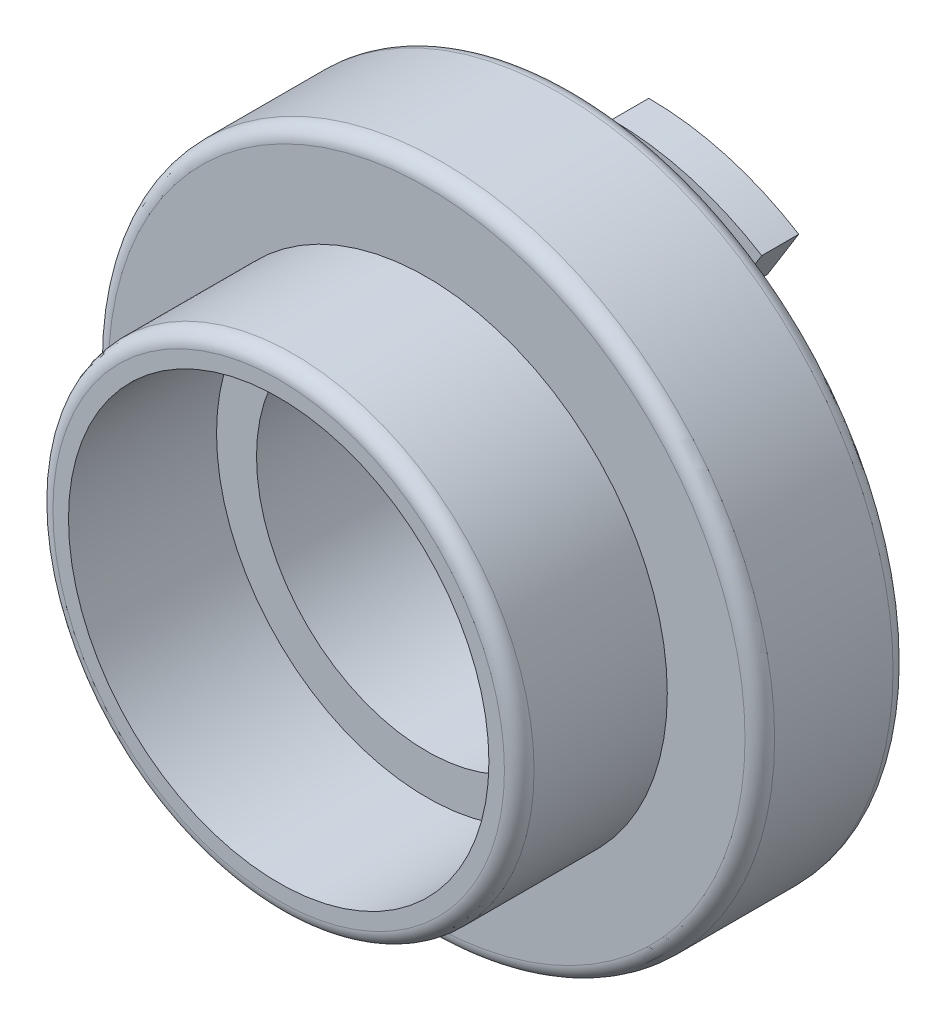
from build123d import *

# Parameters (mm, degrees)
SKETCH1_R           = 41.275
BOSS_EXTRUDE1_DEPTH = 25.4
SKETCH2_R           = 36.068
CUT_EXTRUDE1_DEPTH  = 25.4
SKETCH3_R           = 57.15
BOSS_EXTRUDE2_DEPTH = 25.4
SKETCH4_R           = 29.21
CUT_EXTRUDE2_DEPTH  = 96.461432003
CUT_EXTRUDE4_DEPTH  = 22.86
CUT_EXTRUDE5_DEPTH  = 20.32
BOSS_EXTRUDE3_DEPTH = 6.35
BOSS_EXTRUDE4_DEPTH = 6.35
BOSS_EXTRUDE5_DEPTH = 6.35
BOSS_EXTRUDE6_DEPTH = 6.35
CUT_EXTRUDE6_DEPTH  = 22.86
CUT_EXTRUDE7_DEPTH  = 20.32
SKETCH15_R          = 34.29
SKETCH15_R_2        = 30.48
CUT_EXTRUDE8_DEPTH  = 12.7
FILLET1_R           = 2.54


with BuildPart() as part:
    # Sketch1 → Boss-Extrude1 (new body)
    with BuildSketch(Plane.XY):
        Circle(SKETCH1_R)
    extrude(amount=BOSS_EXTRUDE1_DEPTH)

    # Sketch2 → Cut-Extrude1 (cut)
    with BuildSketch(Plane.XY.offset(25.4)):
        Circle(SKETCH2_R)
    extrude(amount=-CUT_EXTRUDE1_DEPTH, mode=Mode.SUBTRACT)

    # Sketch3 → Boss-Extrude2 (add)
    with BuildSketch(Plane(origin=(0, 0, 0), x_dir=(-1, 0, 0), z_dir=(0, 0, -1))):
        Circle(SKETCH3_R)
    extrude(amount=BOSS_EXTRUDE2_DEPTH)

    # Sketch4 → Cut-Extrude2 (cut, through all)
    with BuildSketch(Plane(origin=(0, 0, -25.4), x_dir=(-1, 0, 0), z_dir=(0, 0, -1))):
        Circle(SKETCH4_R)
    extrude(amount=-CUT_EXTRUDE2_DEPTH, mode=Mode.SUBTRACT)

    # Sketch6 → Cut-Extrude4 (cut)
    with BuildSketch(Plane(origin=(0, 0, -25.4), x_dir=(-1, 0, 0), z_dir=(0, 0, -1))):
        with BuildLine():
            Line((18.506279238, -30.364967129), (24.454726136, -40.125135135))
            ThreePointArc((24.454726136, -40.125135135), (46.842589674, -3.719125253), (30.48, 35.763524714))
            ThreePointArc((30.48, 35.763524714), (28.349648711, 38.283083694), (27.139008157, 41.35243599))
            ThreePointArc((27.139008157, 41.35243599), (26.51640571, 42.835799248), (25.4, 43.994090512))
            ThreePointArc((25.4, 43.994090512), (13.148007491, 49.069031975), (0, 50.8))
            Line((0, 50.8), (0, 35.56))
            ThreePointArc((0, 35.56), (34.23661659, 9.610810811), (18.506279238, -30.364967129))
        make_face()
    extrude(amount=-CUT_EXTRUDE4_DEPTH, mode=Mode.SUBTRACT)

    # Sketch8 → Cut-Extrude5 (cut)
    with BuildSketch(Plane(origin=(0, 0, -22.86), x_dir=(-1, 0, 0), z_dir=(0, 0, -1))):
        with BuildLine():
            Line((26.437541769, -43.37852447), (24.454726136, -40.125135135))
            ThreePointArc((24.454726136, -40.125135135), (46.842589674, -3.719125253), (30.48, 35.763524714))
            ThreePointArc((30.48, 35.763524714), (28.349648711, 38.283083694), (27.139008157, 41.35243599))
            ThreePointArc((27.139008157, 41.35243599), (26.51640571, 42.835799248), (25.4, 43.994090512))
            ThreePointArc((25.4, 43.994090512), (50.796418637, 0.6032028), (26.437541769, -43.37852447))
        make_face()
    extrude(amount=-CUT_EXTRUDE5_DEPTH, mode=Mode.SUBTRACT)

    # Sketch9 → Boss-Extrude3 (add)
    with BuildSketch(Plane(origin=(0, 0, -25.4), x_dir=(-1, 0, 0), z_dir=(0, 0, -1))):
        with BuildLine():
            Line((0, 44.45), (0, 38.608))
            ThreePointArc((0, 38.608), (-10.589622857, 37.127315439), (-20.36698447, 32.798835461))
            Line((-20.36698447, 32.798835461), (-23.448830804, 37.761817143))
            ThreePointArc((-23.448830804, 37.761817143), (-12.192, 42.745264486), (0, 44.45))
        make_face()
    extrude(amount=BOSS_EXTRUDE3_DEPTH)

    # Sketch10 → Boss-Extrude4 (add)
    with BuildSketch(Plane(origin=(0, 0, -31.75), x_dir=(-1, 0, 0), z_dir=(0, 0, -1))):
        with BuildLine():
            Line((-20.36698447, 32.798835461), (-25.726717225, 41.430107951))
            ThreePointArc((-25.726717225, 41.430107951), (-13.376365714, 46.897661608), (0, 48.768))
            Line((0, 48.768), (0, 38.608))
            ThreePointArc((0, 38.608), (-10.589622857, 37.127315439), (-20.36698447, 32.798835461))
        make_face()
    extrude(amount=BOSS_EXTRUDE4_DEPTH)

    # Sketch11 → Boss-Extrude5 (add)
    with BuildSketch(Plane(origin=(0, 0, -25.4), x_dir=(-1, 0, 0), z_dir=(0, 0, -1))):
        with BuildLine():
            Line((0, -46.228), (0, -38.608))
            ThreePointArc((0, -38.608), (10.434594595, -37.171183727), (20.092531744, -32.967678598))
            Line((20.092531744, -32.967678598), (24.058163009, -39.474457268))
            ThreePointArc((24.058163009, -39.474457268), (12.494054054, -44.507601568), (0, -46.228))
        make_face()
    extrude(amount=BOSS_EXTRUDE5_DEPTH)

    # Sketch12 → Boss-Extrude6 (add)
    with BuildSketch(Plane(origin=(0, 0, -31.75), x_dir=(-1, 0, 0), z_dir=(0, 0, -1))):
        with BuildLine():
            Line((0, -38.608), (0, -48.768))
            ThreePointArc((0, -48.768), (13.180540541, -46.953074181), (25.380040098, -41.643383492))
            Line((25.380040098, -41.643383492), (20.092531744, -32.967678598))
            ThreePointArc((20.092531744, -32.967678598), (10.434594595, -37.171183727), (0, -38.608))
        make_face()
    extrude(amount=BOSS_EXTRUDE6_DEPTH)

    # Sketch13 → Cut-Extrude6 (cut)
    with BuildSketch(Plane(origin=(0, 0, -25.4), x_dir=(-1, 0, 0), z_dir=(0, 0, -1))):
        with BuildLine():
            Line((0, -35.56), (0, -50.8))
            ThreePointArc((0, -50.8), (-13.148007491, -49.069031975), (-25.4, -43.994090512))
            ThreePointArc((-25.4, -43.994090512), (-27.380071612, -41.913162133), (-27.914964156, -39.090957945))
            ThreePointArc((-27.914964156, -39.090957945), (-29.023609665, -37.293207394), (-30.48, -35.763524714))
            ThreePointArc((-30.48, -35.763524714), (-46.857702082, 3.52361399), (-24.788763993, 39.919635265))
            Line((-24.788763993, 39.919635265), (-18.759064643, 30.209453714))
            ThreePointArc((-18.759064643, 30.209453714), (-34.196211589, -9.7536), (0, -35.56))
        make_face()
    extrude(amount=-CUT_EXTRUDE6_DEPTH, mode=Mode.SUBTRACT)

    # Sketch14 → Cut-Extrude7 (cut)
    with BuildSketch(Plane(origin=(0, 0, -22.86), x_dir=(-1, 0, 0), z_dir=(0, 0, -1))):
        with BuildLine():
            Line((-26.798663776, 43.156362449), (-24.788763993, 39.919635265))
            ThreePointArc((-24.788763993, 39.919635265), (-46.857702082, 3.52361399), (-30.48, -35.763524714))
            ThreePointArc((-30.48, -35.763524714), (-29.023609665, -37.293207394), (-27.914964156, -39.090957945))
            ThreePointArc((-27.914964156, -39.090957945), (-27.380071612, -41.913162133), (-25.4, -43.994090512))
            ThreePointArc((-25.4, -43.994090512), (-50.793459105, -0.815176157), (-26.798663776, 43.156362449))
        make_face()
    extrude(amount=-CUT_EXTRUDE7_DEPTH, mode=Mode.SUBTRACT)

    # Sketch15 → Cut-Extrude8 (cut)
    with BuildSketch(Plane(origin=(0, 0, -25.4), x_dir=(-1, 0, 0), z_dir=(0, 0, -1))):
        Circle(SKETCH15_R)
        Circle(SKETCH15_R_2, mode=Mode.SUBTRACT)
    extrude(amount=-CUT_EXTRUDE8_DEPTH, mode=Mode.SUBTRACT)

    # Fillet1
    fillet1_edges = [part.edges().sort_by_distance(p)[0] for p in [
        (57.15, 0, 0),
        (57.15, 0, -25.4),
        (-41.275, 0, 25.4),
    ]]
    fillet(fillet1_edges, radius=FILLET1_R)


solid = part.part
